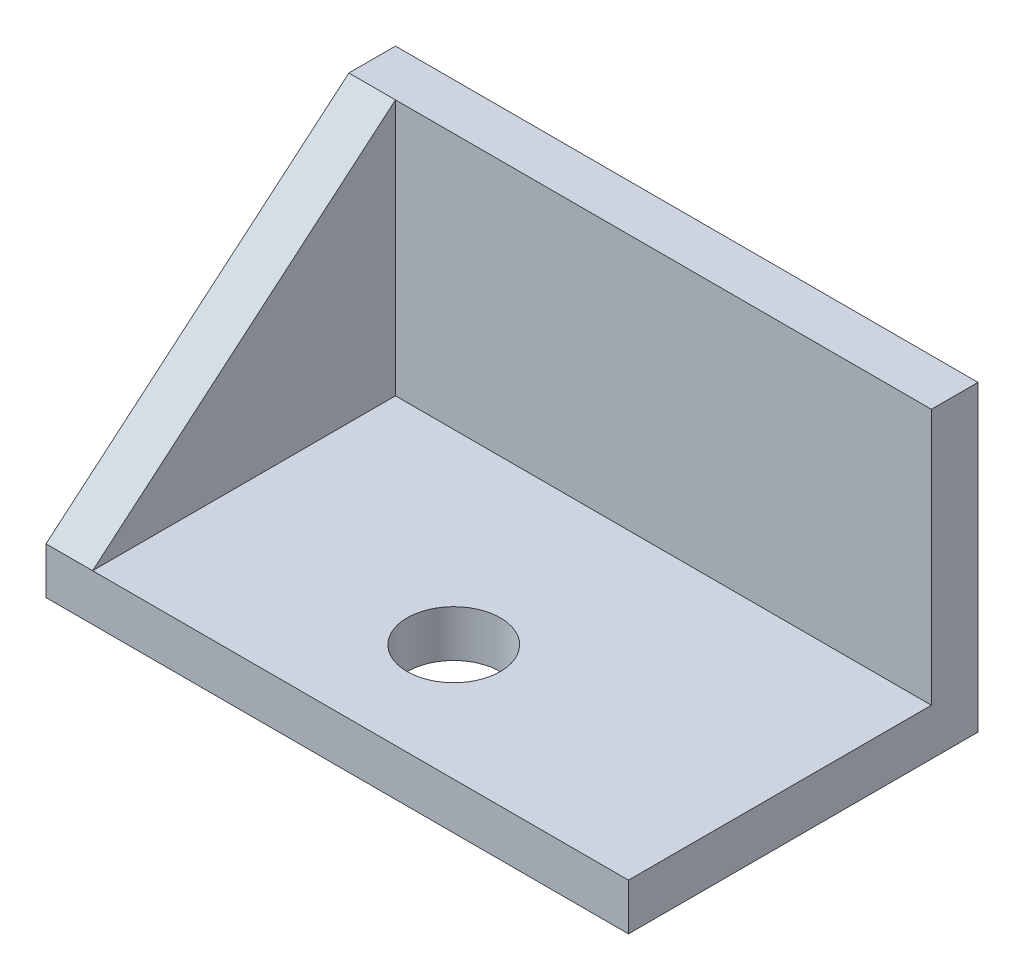
from build123d import *

# Parameters (mm, degrees)
BOSS_EXTRUDE2_DEPTH = 125
BOSS_EXTRUDE3_DEPTH = 10
SKETCH2_R           = 10
CUT_EXTRUDE1_DEPTH  = 10


with BuildPart() as part:
    # Sketch1 → Boss-Extrude2 (new body)
    with BuildSketch(Plane(origin=(0, 0, 0), x_dir=(0, 0, -1), z_dir=(1, 0, 0))):
        Polygon((-75, 0), (0, 0), (0, 65), (-10, 65), (-10, 10), (-75, 10), align=None)
    extrude(amount=BOSS_EXTRUDE2_DEPTH)

    # Sketch1<3> → Boss-Extrude3 (add)
    with BuildSketch(Plane(origin=(0, 0, 0), x_dir=(0, 0, -1), z_dir=(1, 0, 0))):
        Polygon((-10, 10), (-10, 65), (-75, 10), align=None)
    extrude(amount=BOSS_EXTRUDE3_DEPTH)

    # Sketch2 → Cut-Extrude1 (cut)
    with BuildSketch(Plane(origin=(0, 10, 0), x_dir=(1, 0, 0), z_dir=(0, 1, 0))):
        with Locations((62.5, -50)):
            Circle(SKETCH2_R)
    extrude(amount=-CUT_EXTRUDE1_DEPTH, mode=Mode.SUBTRACT)


solid = part.part
